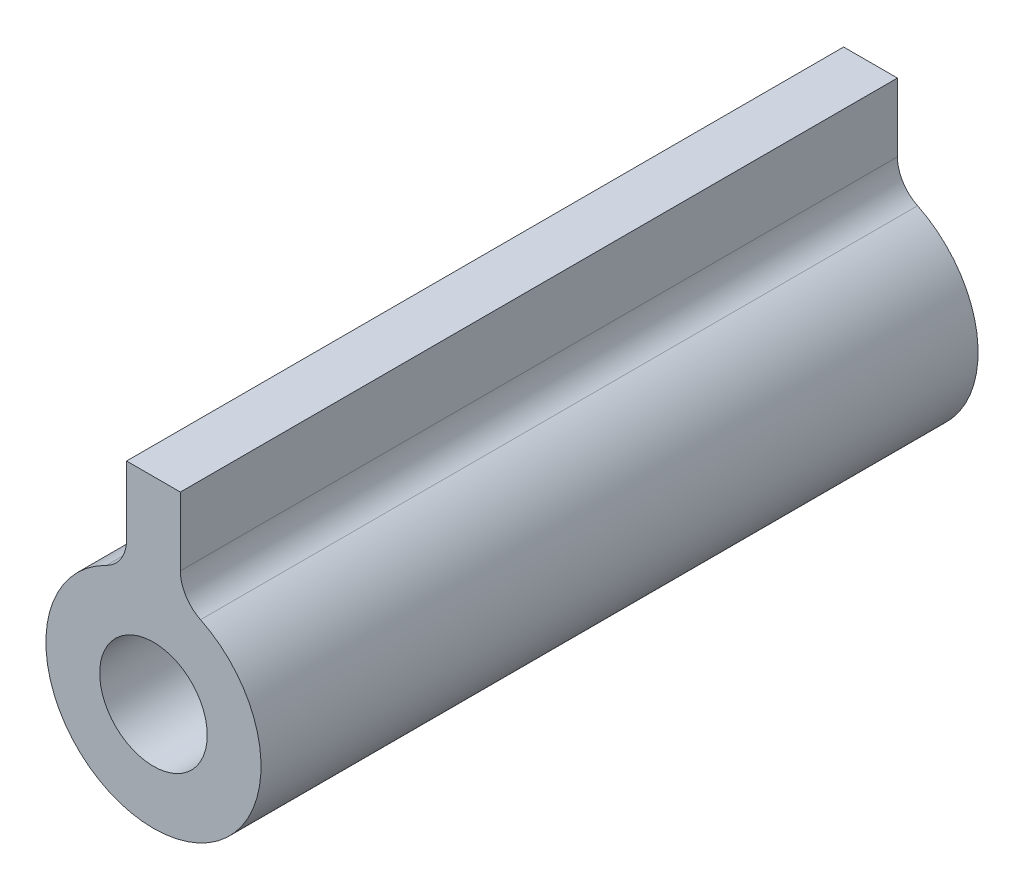
from build123d import *

# Parameters (mm, degrees)
SKETCH1_R           = 3
BOSS_EXTRUDE1_DEPTH = 40
FILLET1_R           = 2


with BuildPart() as part:
    # Sketch1 → Boss-Extrude1 (new body)
    with BuildSketch(Plane.XY):
        with BuildLine():
            Line((-1.5, 5.809475019), (-1.5, 11))
            Line((-1.5, 11), (1.5, 11))
            Line((1.5, 11), (1.5, 5.809475019))
            ThreePointArc((1.5, 5.809475019), (0, -6), (-1.5, 5.809475019))
        make_face()
        Circle(SKETCH1_R, mode=Mode.SUBTRACT)
    extrude(amount=BOSS_EXTRUDE1_DEPTH)

    # Fillet1
    fillet1_edges = [part.edges().sort_by_distance(p)[0] for p in [
        (1.5, 5.809475019, 20),
        (-1.5, 5.809475019, 20),
    ]]
    fillet(fillet1_edges, radius=FILLET1_R)


solid = part.part
